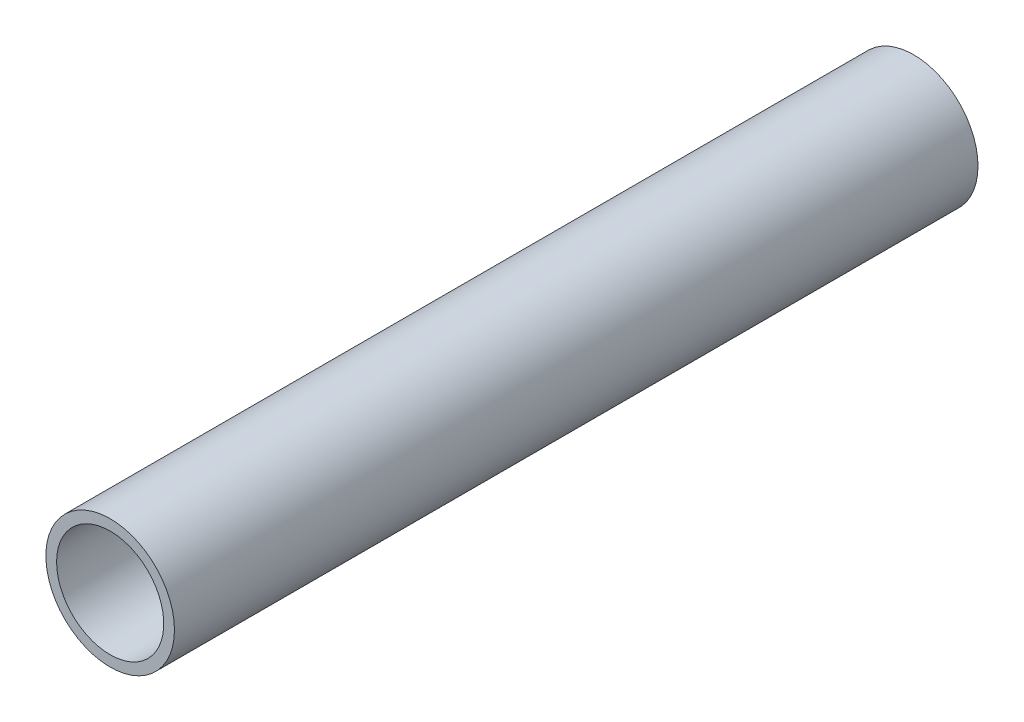
from build123d import *

# Parameters (mm, degrees)
SKETCH1_R           = 12
BOSS_EXTRUDE1_DEPTH = 150
SKETCH2_R           = 10
CUT_EXTRUDE1_DEPTH  = 150


with BuildPart() as part:
    # Sketch1 → Boss-Extrude1 (new body)
    with BuildSketch(Plane.XY):
        Circle(SKETCH1_R)
    extrude(amount=BOSS_EXTRUDE1_DEPTH)

    # Sketch2 → Cut-Extrude1 (cut)
    with BuildSketch(Plane(origin=(0, 0, 0), x_dir=(-1, 0, 0), z_dir=(0, 0, -1))):
        Circle(SKETCH2_R)
    extrude(amount=-CUT_EXTRUDE1_DEPTH, mode=Mode.SUBTRACT)


solid = part.part
